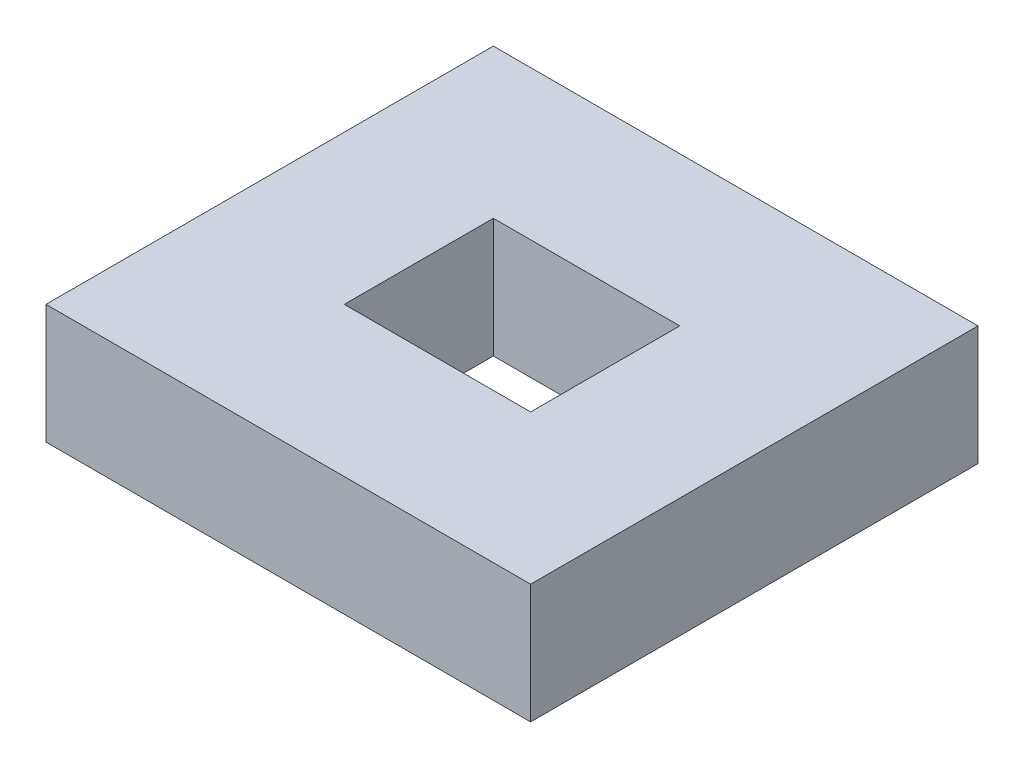
from build123d import *

# Parameters (mm, degrees)
SKETCH1_W           = 10.31875
SKETCH1_H           = 9.525
SKETCH1_W_2         = 3.96875
SKETCH1_H_2         = 3.175
BOSS_EXTRUDE1_DEPTH = 2.54


with BuildPart() as part:
    # Sketch1 → Boss-Extrude1 (new body)
    with BuildSketch(Plane(origin=(0, 0, 0), x_dir=(1, 0, 0), z_dir=(0, 1, 0))):
        Rectangle(SKETCH1_W, SKETCH1_H)
        Rectangle(SKETCH1_W_2, SKETCH1_H_2, mode=Mode.SUBTRACT)
    extrude(amount=BOSS_EXTRUDE1_DEPTH)


solid = part.part
